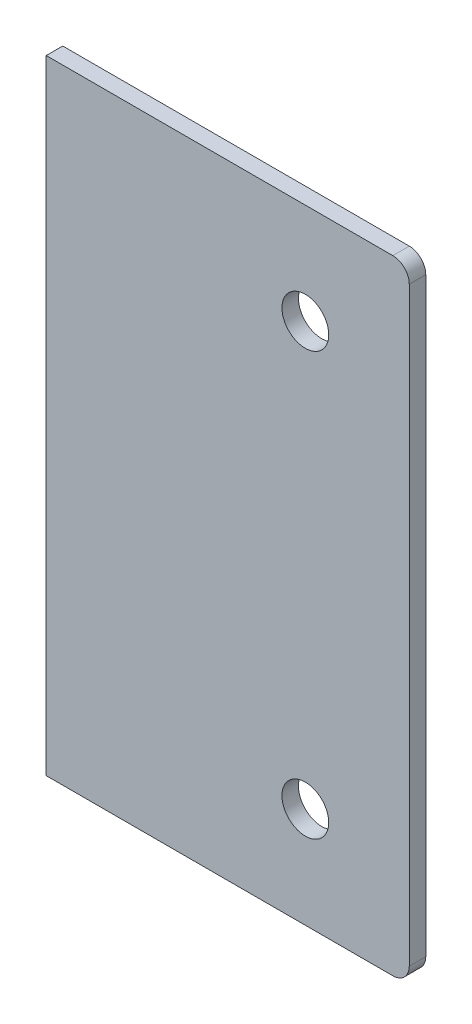
from build123d import *

# Parameters (mm, degrees)
SKETCH1_W            = 34.925
SKETCH1_H            = 60
BOSS_EXTRUDE1_DEPTH  = 1.5875
M4_CLEARANCE_HOLE1_D = 4.5
FILLET1_R            = 1.5875


with BuildPart() as part:
    # Sketch1 → Boss-Extrude1 (new body)
    with BuildSketch(Plane.XY):
        with Locations((-8.076586607, 43.274042014)):
            Rectangle(SKETCH1_W, SKETCH1_H)
    extrude(amount=-BOSS_EXTRUDE1_DEPTH)

    # M4 Clearance Hole1 (through all)
    with Locations(Plane(origin=(0, 0, -1.5875), x_dir=(-1, 0, 0), z_dir=(0, 0, -1))):
        with Locations((0.614086607, 63.594042014), (0.614086607, 22.954042014)):
            Hole(M4_CLEARANCE_HOLE1_D / 2)

    # Fillet1
    fillet1_edges = [part.edges().sort_by_distance(p)[0] for p in [
        (9.385913393, 13.274042014, -0.79375),
        (9.385913393, 73.274042014, -0.79375),
    ]]
    fillet(fillet1_edges, radius=FILLET1_R)


solid = part.part
